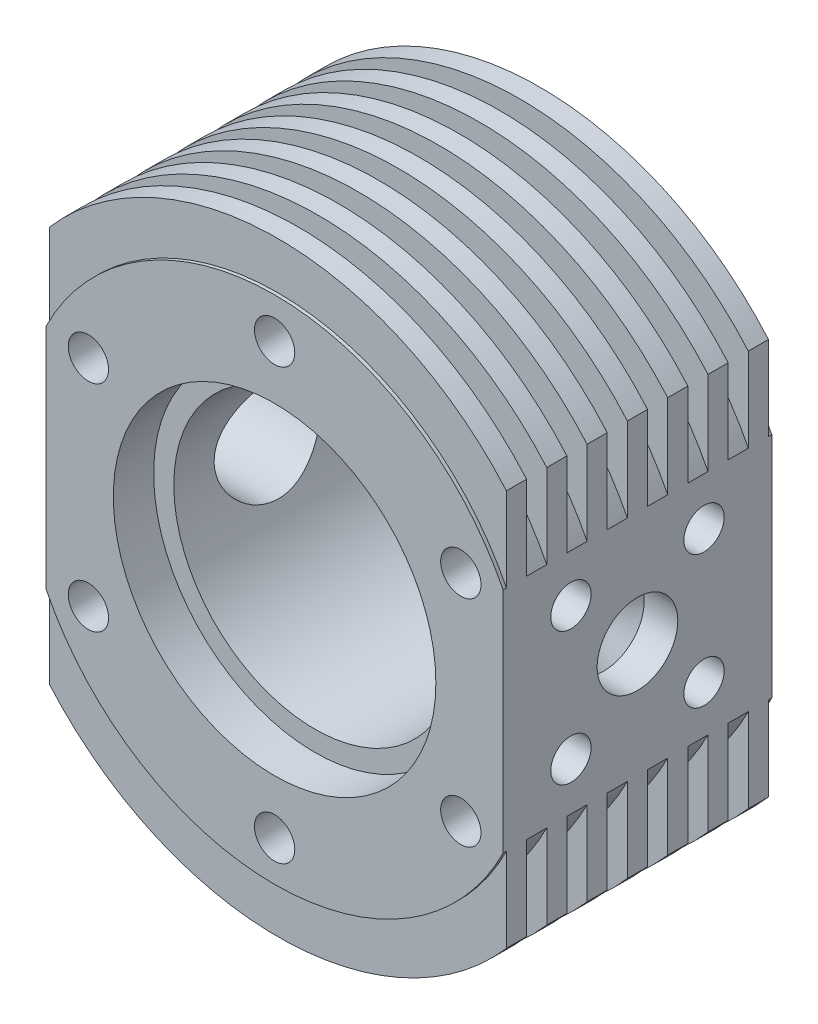
from build123d import *

# Parameters (mm, degrees)
SKETCH1_R               = 10.5
BOSS_EXTRUDE1_DEPTH     = 20
SKETCH2_R               = 12
CUT_EXTRUDE1_DEPTH      = 3
SKETCH3_OUTSIDE_W       = 47.968
SKETCH3_OUTSIDE_H       = 58.968
SKETCH3_OUTSIDE_R       = 19
CUT_EXTRUDE2_DEPTH      = 0.25
SKETCH4_OUTSIDE_W       = 47.968
SKETCH4_OUTSIDE_H       = 58.968
SKETCH4_OUTSIDE_R       = 19
CUT_EXTRUDE3_DEPTH      = 0.25
CUT_EXTRUDE4_START      = -1.5
CUT_EXTRUDE4_DEPTH      = 1.5
LPATTERN1_COUNT         = 6
LPATTERN1_PITCH         = 3
MIRROR1_START           = -1.5
MIRROR1_COPY_1_DEPTH    = 1.5
MIRROR1_COPY_2_DEPTH    = 1.5
MIRROR1_COPY_3_DEPTH    = 1.5
MIRROR1_COPY_4_DEPTH    = 1.5
MIRROR1_COPY_5_DEPTH    = 1.5
CUT_EXTRUDE5_REACH      = 47.412
CUT_EXTRUDE5_END_RADIUS = 10.5
SKETCH6_R               = 4
SKETCH7_R               = 1.5
CUT_EXTRUDE6_DEPTH      = 4
SKETCH9_R               = 1.5
CUT_EXTRUDE7_DEPTH      = 6


with BuildPart() as part:
    # Sketch1 → Boss-Extrude1 (new body)
    with BuildSketch(Plane.XY):
        with BuildLine():
            Line((-17, -14.739402973), (-17, 14.739402973))
            ThreePointArc((-17, 14.739402973), (0, 22.5), (17, 14.739402973))
            Line((17, 14.739402973), (17, -14.739402973))
            ThreePointArc((17, -14.739402973), (0, -22.5), (-17, -14.739402973))
        make_face()
        Circle(SKETCH1_R, mode=Mode.SUBTRACT)
    extrude(amount=BOSS_EXTRUDE1_DEPTH)

    # Sketch2 → Cut-Extrude1 (cut)
    with BuildSketch(Plane.XY.offset(20)):
        Circle(SKETCH2_R)
    extrude(amount=-CUT_EXTRUDE1_DEPTH, mode=Mode.SUBTRACT)

    # Sketch3 outside → Cut-Extrude2 (cut)
    with BuildSketch(Plane.XY):
        Rectangle(SKETCH3_OUTSIDE_W, SKETCH3_OUTSIDE_H)
        Circle(SKETCH3_OUTSIDE_R, mode=Mode.SUBTRACT)
    extrude(amount=CUT_EXTRUDE2_DEPTH, mode=Mode.SUBTRACT)

    # Sketch4 outside → Cut-Extrude3 (cut)
    with BuildSketch(Plane.XY.offset(20)):
        Rectangle(SKETCH4_OUTSIDE_W, SKETCH4_OUTSIDE_H)
        Circle(SKETCH4_OUTSIDE_R, mode=Mode.SUBTRACT)
    extrude(amount=-CUT_EXTRUDE3_DEPTH, mode=Mode.SUBTRACT)

    # Sketch5 → Cut-Extrude4 (cut)
    with BuildSketch(Plane.XY.offset(18.25).offset(CUT_EXTRUDE4_START)):
        with BuildLine():
            Line((-17, -8.485281374), (-17, -14.739402973))
            ThreePointArc((-17, -14.739402973), (0, -22.5), (17, -14.739402973))
            Line((17, -14.739402973), (17, -8.485281374))
            ThreePointArc((17, -8.485281374), (0, -19), (-17, -8.485281374))
        make_face()
    cut_extrude4 = extrude(amount=CUT_EXTRUDE4_DEPTH, mode=Mode.SUBTRACT)

    # LPattern1: Cut-Extrude4 ×6
    with Locations(*[(0, 0, -i * LPATTERN1_PITCH) for i in range(1, LPATTERN1_COUNT)]):
        add(cut_extrude4, mode=Mode.SUBTRACT)

    # Mirror1: Cut-Extrude4 across plane
    add(cut_extrude4.mirror(Plane.ZX), mode=Mode.SUBTRACT)

    # Mirror1 copy 1 sketch → Mirror1 copy 1 (cut)
    with BuildSketch(Plane.XY.offset(15.25).offset(MIRROR1_START)):
        with BuildLine():
            Line((-17, 8.485281374), (-17, 14.739402973))
            ThreePointArc((-17, 14.739402973), (0, 22.5), (17, 14.739402973))
            Line((17, 14.739402973), (17, 8.485281374))
            ThreePointArc((17, 8.485281374), (0, 19), (-17, 8.485281374))
        make_face()
    extrude(amount=MIRROR1_COPY_1_DEPTH, mode=Mode.SUBTRACT)

    # Mirror1 copy 2 sketch → Mirror1 copy 2 (cut)
    with BuildSketch(Plane.XY.offset(12.25).offset(MIRROR1_START)):
        with BuildLine():
            Line((-17, 8.485281374), (-17, 14.739402973))
            ThreePointArc((-17, 14.739402973), (0, 22.5), (17, 14.739402973))
            Line((17, 14.739402973), (17, 8.485281374))
            ThreePointArc((17, 8.485281374), (0, 19), (-17, 8.485281374))
        make_face()
    extrude(amount=MIRROR1_COPY_2_DEPTH, mode=Mode.SUBTRACT)

    # Mirror1 copy 3 sketch → Mirror1 copy 3 (cut)
    with BuildSketch(Plane.XY.offset(9.25).offset(MIRROR1_START)):
        with BuildLine():
            Line((-17, 8.485281374), (-17, 14.739402973))
            ThreePointArc((-17, 14.739402973), (0, 22.5), (17, 14.739402973))
            Line((17, 14.739402973), (17, 8.485281374))
            ThreePointArc((17, 8.485281374), (0, 19), (-17, 8.485281374))
        make_face()
    extrude(amount=MIRROR1_COPY_3_DEPTH, mode=Mode.SUBTRACT)

    # Mirror1 copy 4 sketch → Mirror1 copy 4 (cut)
    with BuildSketch(Plane.XY.offset(6.25).offset(MIRROR1_START)):
        with BuildLine():
            Line((-17, 8.485281374), (-17, 14.739402973))
            ThreePointArc((-17, 14.739402973), (0, 22.5), (17, 14.739402973))
            Line((17, 14.739402973), (17, 8.485281374))
            ThreePointArc((17, 8.485281374), (0, 19), (-17, 8.485281374))
        make_face()
    extrude(amount=MIRROR1_COPY_4_DEPTH, mode=Mode.SUBTRACT)

    # Mirror1 copy 5 sketch → Mirror1 copy 5 (cut)
    with BuildSketch(Plane.XY.offset(3.25).offset(MIRROR1_START)):
        with BuildLine():
            Line((-17, 8.485281374), (-17, 14.739402973))
            ThreePointArc((-17, 14.739402973), (0, 22.5), (17, 14.739402973))
            Line((17, 14.739402973), (17, 8.485281374))
            ThreePointArc((17, 8.485281374), (0, 19), (-17, 8.485281374))
        make_face()
    extrude(amount=MIRROR1_COPY_5_DEPTH, mode=Mode.SUBTRACT)

    # Cut-Extrude5: up to this cylinder (the profile starts outside it)
    cut_extrude5_end = Plane(origin=(0, 0, 10), z_dir=(0, 0, -1)) * Cylinder(CUT_EXTRUDE5_END_RADIUS, 116.824, mode=Mode.PRIVATE)
    # Sketch6 → Cut-Extrude5 (cut, up to the surface)
    with BuildSketch(Plane.ZY.offset(17), mode=Mode.PRIVATE) as cut_extrude5_sk1:
        with Locations((10, 0)):
            Circle(SKETCH6_R)
    cut_extrude5_tool1 = extrude(cut_extrude5_sk1.sketch, amount=-CUT_EXTRUDE5_REACH, mode=Mode.PRIVATE) - cut_extrude5_end
    add(cut_extrude5_tool1.solids().sort_by_distance((-17, 0, 10))[0], mode=Mode.SUBTRACT)

    # Sketch7 → Cut-Extrude6 (cut)
    with BuildSketch(Plane.ZY.offset(17)):
        with Locations((14.949747468, 4.949747468)):
            Circle(SKETCH7_R)
        with Locations((14.949747468, -4.949747468)):
            Circle(SKETCH7_R)
        with Locations((5.050252532, -4.949747468)):
            Circle(SKETCH7_R)
        with Locations((5.050252532, 4.949747468)):
            Circle(SKETCH7_R)
    cut_extrude6 = extrude(amount=-CUT_EXTRUDE6_DEPTH, mode=Mode.SUBTRACT)

    # Sketch8 → Cut-Revolve1 (revolve, cut)
    with BuildSketch(Plane(origin=(0, 0, 10), x_dir=(-1, 0, 0), z_dir=(0, 0, -1)), mode=Mode.PRIVATE) as cut_revolve1_sk:
        Polygon((-17, 0), (-11.5, 0), (-14.5, -3), (-17, -3), align=None)
    revolve(cut_revolve1_sk.sketch.rotate(Axis((17, 0, 10), (-1, 0, 0)), 270), axis=Axis((17, 0, 10), (-1, 0, 0)), mode=Mode.SUBTRACT)

    # Mirror2: Cut-Extrude6 across plane
    add(cut_extrude6.mirror(Plane(origin=(0, 0, 0), x_dir=(0, 0, 1), z_dir=(1, 0, 0))), mode=Mode.SUBTRACT)

    # Sketch9 → Cut-Extrude7 (cut)
    with BuildSketch(Plane.XY.offset(20)):
        with Locations((0, 16)):
            Circle(SKETCH9_R)
        with Locations((13.856406461, 8)):
            Circle(SKETCH9_R)
        with Locations((13.856406461, -8)):
            Circle(SKETCH9_R)
        with Locations((0, -16)):
            Circle(SKETCH9_R)
        with Locations((-13.856406461, -8)):
            Circle(SKETCH9_R)
        with Locations((-13.856406461, 8)):
            Circle(SKETCH9_R)
    cut_extrude7 = extrude(amount=-CUT_EXTRUDE7_DEPTH, mode=Mode.SUBTRACT)

    # Mirror3: Cut-Extrude7 across plane
    add(cut_extrude7.mirror(Plane(origin=(0, 0, 10), x_dir=(1, 0, 0), z_dir=(0, 0, -1))), mode=Mode.SUBTRACT)


solid = part.part
